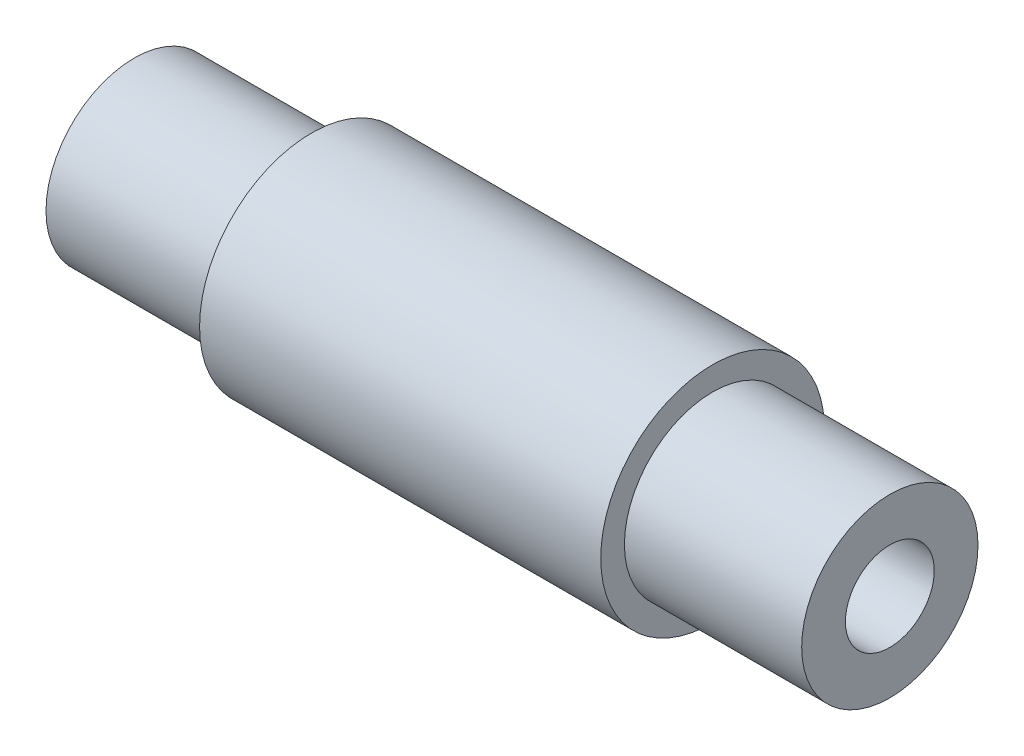
from build123d import *

# Parameters (mm, degrees)
SOCKET_1_SKETCH_W = 17.8
SOCKET_1_SKETCH_H = 4.7625
SOCKET_2_SKETCH_W = 17.8
SOCKET_2_SKETCH_H = 4.7625


with BuildPart() as part:
    # Filter_F2_T6 Sketch → Filter_F2_T6 (revolve)
    with BuildSketch(Plane.XY):
        Polygon((-40.5, 0), (-40.5, 9.45), (-21.5, 9.45), (-21.5, 11.988), (21.5, 11.988), (21.5, 9.45), (40.5, 9.45), (40.5, 0), align=None)
    revolve(axis=Axis((-1000, 0, 0), (1, 0, 0)))

    # Socket 1 Sketch → Socket 1 (revolve, cut)
    with BuildSketch(Plane.XY):
        with Locations((-32.6, 2.38125)):
            Rectangle(SOCKET_1_SKETCH_W, SOCKET_1_SKETCH_H)
    revolve(axis=Axis((-1000, 0, 0), (1, 0, 0)), mode=Mode.SUBTRACT)

    # Socket 2 Sketch → Socket 2 (revolve, cut)
    with BuildSketch(Plane.XY):
        with Locations((32.6, 2.38125)):
            Rectangle(SOCKET_2_SKETCH_W, SOCKET_2_SKETCH_H)
    revolve(axis=Axis((-1000, 0, 0), (1, 0, 0)), mode=Mode.SUBTRACT)


solid = part.part
